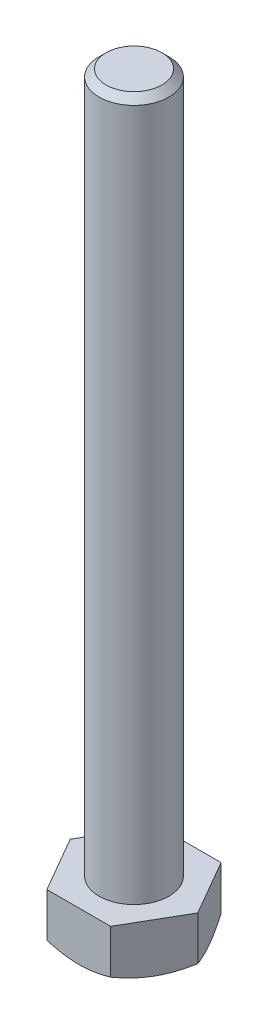
from build123d import *

# Parameters (mm, degrees)
BOSS_EXTRUDE1_DEPTH = 53.5
SKETCH2_OUTSIDE_W   = 22.09
SKETCH2_OUTSIDE_H   = 20.868
SKETCH2_OUTSIDE_R   = 2.5
CUT_EXTRUDE1_DEPTH  = 50
CHAMFER1_SIZE       = 0.5


with BuildPart() as part:
    # Sketch1 → Boss-Extrude1 (new body)
    with BuildSketch(Plane(origin=(0, 0, 0), x_dir=(1, 0, 0), z_dir=(0, 1, 0))):
        Polygon((4.561067127, 0), (2.280533563, 3.95), (-2.280533563, 3.95), (-4.561067127, 0), (-2.280533563, -3.95), (2.280533563, -3.95), align=None)
    extrude(amount=BOSS_EXTRUDE1_DEPTH)

    # Sketch2 outside → Cut-Extrude1 (cut)
    with BuildSketch(Plane(origin=(0, 53.5, 0), x_dir=(1, 0, 0), z_dir=(0, 1, 0))):
        Rectangle(SKETCH2_OUTSIDE_W, SKETCH2_OUTSIDE_H)
        with Locations(Location((0, 0, 0), (0, 0, 270))):
            Circle(SKETCH2_OUTSIDE_R, mode=Mode.SUBTRACT)
    extrude(amount=-CUT_EXTRUDE1_DEPTH, mode=Mode.SUBTRACT)

    # Sketch3 → Cut-Revolve1 (revolve, cut)
    with BuildSketch(Plane(origin=(0, 0, 0), x_dir=(0, 0, -1), z_dir=(1, 0, 0))):
        Polygon((3.95, 0), (5.249038106, 0.75), (5.249038106, -0.75), align=None)
    revolve(axis=Axis((0, 3.5, 0), (0, 1, 0)), mode=Mode.SUBTRACT)

    # Chamfer1
    chamfer1_edges = [part.edges().sort_by_distance(p)[0] for p in [
        (0, 53.5, -2.5),
    ]]
    chamfer(chamfer1_edges, length=CHAMFER1_SIZE)


solid = part.part
